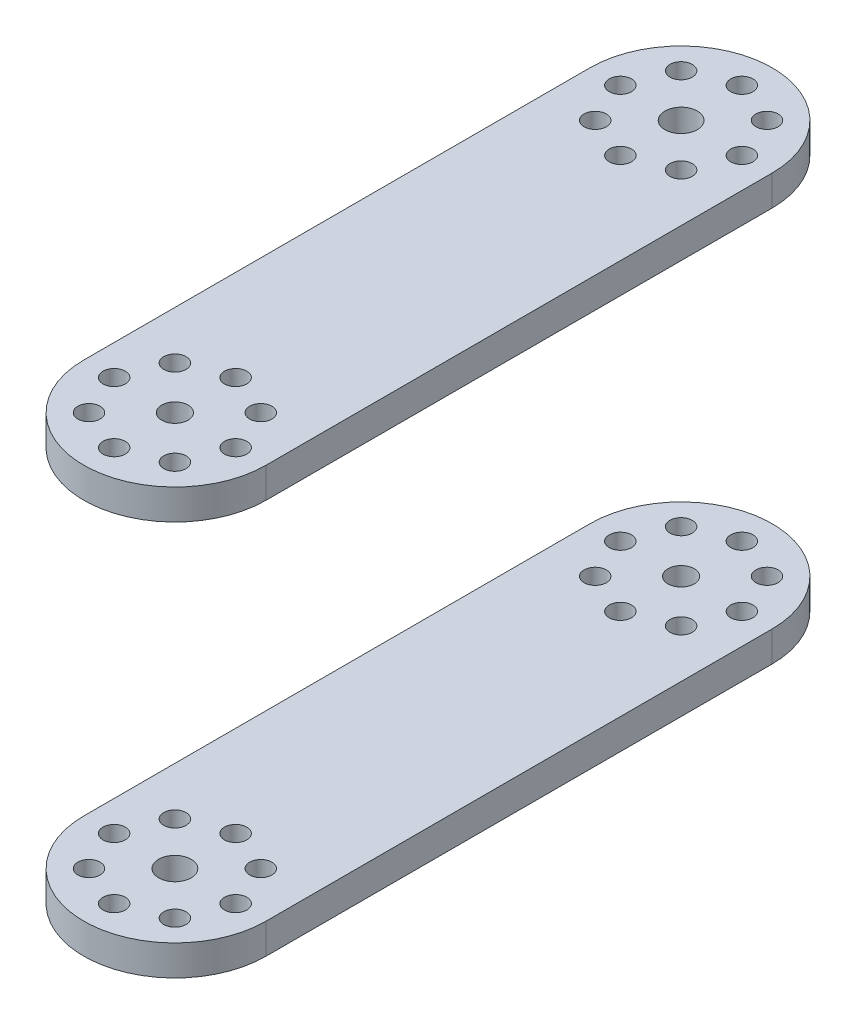
from build123d import *

# Parameters (mm, degrees)
SKETCH_1_R      = 1.1
SKETCH_1_R_2    = 1.6
SKETCH_1_R_3    = 1.3
EXTRUDE_1_DEPTH = 3
SKETCH_2_R      = 1.3
SKETCH_2_R_2    = 1.1
SKETCH_2_R_3    = 1.6
EXTRUDE_2_DEPTH = 3


with BuildPart() as part:
    # ｽｹｯﾁ1 → ﾎﾞｽ - 押し出し1 (new body)
    with BuildSketch(Plane(origin=(0, 0, 0), x_dir=(1, 0, 0), z_dir=(0, 1, 0))):
        with BuildLine():
            Line((-9, 50), (-9, 0))
            ThreePointArc((-9, 0), (0, -9), (9, 0))
            Line((9, 0), (9, 50))
            ThreePointArc((9, 50), (0, 59), (-9, 50))
        make_face()
        with Locations(Location((0, 56, 0), (0, 0, 270))):
            Circle(SKETCH_1_R, mode=Mode.SUBTRACT)
        with Locations(Location((4.242640687, 54.242640687, 0), (0, 0, 270))):
            Circle(SKETCH_1_R, mode=Mode.SUBTRACT)
        with Locations(Location((6, 50, 0), (0, 0, 270))):
            Circle(SKETCH_1_R, mode=Mode.SUBTRACT)
        with Locations(Location((4.242640687, 45.757359313, 0), (0, 0, 270))):
            Circle(SKETCH_1_R, mode=Mode.SUBTRACT)
        with Locations(Location((0, 44, 0), (0, 0, 270))):
            Circle(SKETCH_1_R, mode=Mode.SUBTRACT)
        with Locations(Location((-4.242640687, 45.757359313, 0), (0, 0, 270))):
            Circle(SKETCH_1_R, mode=Mode.SUBTRACT)
        with Locations(Location((-6, 50, 0), (0, 0, 270))):
            Circle(SKETCH_1_R, mode=Mode.SUBTRACT)
        with Locations(Location((-4.242640687, 54.242640687, 0), (0, 0, 270))):
            Circle(SKETCH_1_R, mode=Mode.SUBTRACT)
        with Locations(Location((0, 50, 0), (0, 0, 270))):
            Circle(SKETCH_1_R_2, mode=Mode.SUBTRACT)
        with Locations(Location((0, 0, 0), (0, 0, 270))):
            Circle(SKETCH_1_R_3, mode=Mode.SUBTRACT)
        with Locations(Location((0, 6, 0), (0, 0, 270))):
            Circle(SKETCH_1_R, mode=Mode.SUBTRACT)
        with Locations(Location((4.242640687, 4.242640687, 0), (0, 0, 270))):
            Circle(SKETCH_1_R, mode=Mode.SUBTRACT)
        with Locations(Location((6, 0, 0), (0, 0, 270))):
            Circle(SKETCH_1_R, mode=Mode.SUBTRACT)
        with Locations(Location((4.242640687, -4.242640687, 0), (0, 0, 270))):
            Circle(SKETCH_1_R, mode=Mode.SUBTRACT)
        with Locations(Location((0, -6, 0), (0, 0, 270))):
            Circle(SKETCH_1_R, mode=Mode.SUBTRACT)
        with Locations(Location((-4.242640687, -4.242640687, 0), (0, 0, 270))):
            Circle(SKETCH_1_R, mode=Mode.SUBTRACT)
        with Locations(Location((-6, 0, 0), (0, 0, 270))):
            Circle(SKETCH_1_R, mode=Mode.SUBTRACT)
        with Locations(Location((-4.242640687, 4.242640687, 0), (0, 0, 270))):
            Circle(SKETCH_1_R, mode=Mode.SUBTRACT)
    extrude(amount=EXTRUDE_1_DEPTH)


with BuildPart() as body_2:
    # ｽｹｯﾁ2 → ﾎﾞｽ - 押し出し2 (new body)
    with BuildSketch(Plane(origin=(0, -36, 0), x_dir=(1, 0, 0), z_dir=(0, 1, 0))):
        with BuildLine():
            Line((9, 0), (9, 50))
            ThreePointArc((9, 50), (0, 59), (-9, 50))
            Line((-9, 50), (-9, 0))
            ThreePointArc((-9, 0), (0, -9), (9, 0))
        make_face()
        with Locations(Location((0, 50, 0), (0, 0, 270))):
            Circle(SKETCH_2_R, mode=Mode.SUBTRACT)
        with Locations(Location((0, 56, 0), (0, 0, 270))):
            Circle(SKETCH_2_R_2, mode=Mode.SUBTRACT)
        with Locations(Location((4.242640687, 54.242640687, 0), (0, 0, 270))):
            Circle(SKETCH_2_R_2, mode=Mode.SUBTRACT)
        with Locations(Location((6, 50, 0), (0, 0, 270))):
            Circle(SKETCH_2_R_2, mode=Mode.SUBTRACT)
        with Locations(Location((0, 0, 0), (0, 0, 270))):
            Circle(SKETCH_2_R_3, mode=Mode.SUBTRACT)
        with Locations(Location((0, 6, 0), (0, 0, 270))):
            Circle(SKETCH_2_R_2, mode=Mode.SUBTRACT)
        with Locations(Location((4.242640687, 4.242640687, 0), (0, 0, 270))):
            Circle(SKETCH_2_R_2, mode=Mode.SUBTRACT)
        with Locations(Location((6, 0, 0), (0, 0, 270))):
            Circle(SKETCH_2_R_2, mode=Mode.SUBTRACT)
        with Locations(Location((4.242640687, -4.242640687, 0), (0, 0, 270))):
            Circle(SKETCH_2_R_2, mode=Mode.SUBTRACT)
        with Locations(Location((0, -6, 0), (0, 0, 270))):
            Circle(SKETCH_2_R_2, mode=Mode.SUBTRACT)
        with Locations(Location((-4.242640687, -4.242640687, 0), (0, 0, 270))):
            Circle(SKETCH_2_R_2, mode=Mode.SUBTRACT)
        with Locations(Location((-6, 0, 0), (0, 0, 270))):
            Circle(SKETCH_2_R_2, mode=Mode.SUBTRACT)
        with Locations(Location((-4.242640687, 4.242640687, 0), (0, 0, 270))):
            Circle(SKETCH_2_R_2, mode=Mode.SUBTRACT)
        with Locations(Location((4.242640687, 45.757359313, 0), (0, 0, 270))):
            Circle(SKETCH_2_R_2, mode=Mode.SUBTRACT)
        with Locations(Location((0, 44, 0), (0, 0, 270))):
            Circle(SKETCH_2_R_2, mode=Mode.SUBTRACT)
        with Locations(Location((-4.242640687, 45.757359313, 0), (0, 0, 270))):
            Circle(SKETCH_2_R_2, mode=Mode.SUBTRACT)
        with Locations(Location((-6, 50, 0), (0, 0, 270))):
            Circle(SKETCH_2_R_2, mode=Mode.SUBTRACT)
        with Locations(Location((-4.242640687, 54.242640687, 0), (0, 0, 270))):
            Circle(SKETCH_2_R_2, mode=Mode.SUBTRACT)
    extrude(amount=-EXTRUDE_2_DEPTH)


solid = Compound([part.part, body_2.part])
